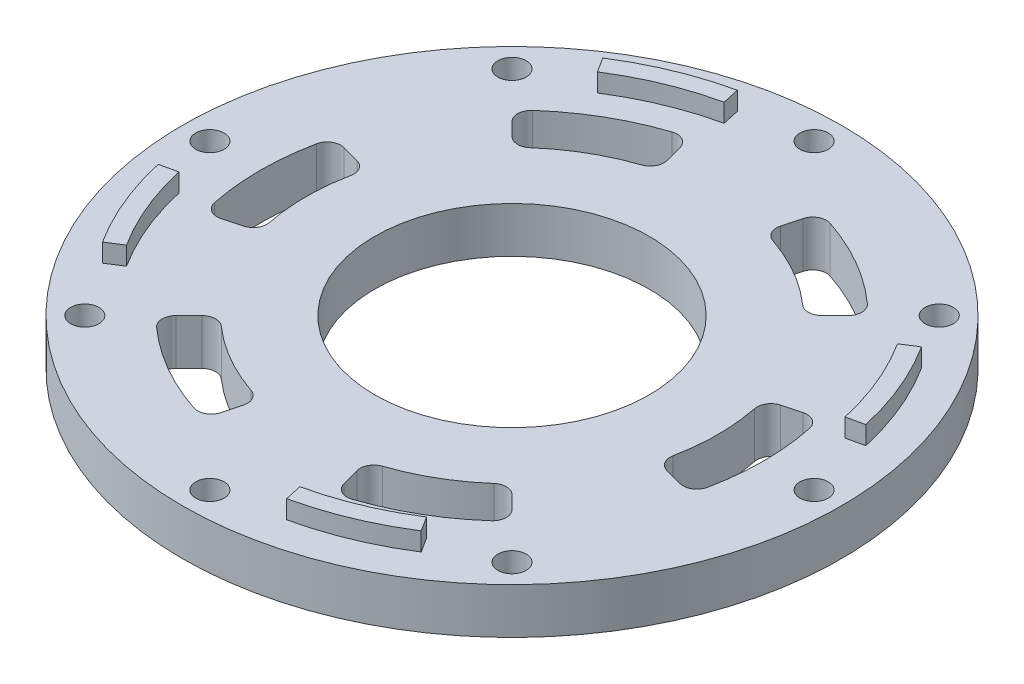
from build123d import *

# Parameters (mm, degrees)
SKETCH1_R                = 36
BOSS_EXTRUDE1_DEPTH      = 5
SKETCH2_R                = 15
CUT_EXTRUDE1_DEPTH       = 5
CUT_EXTRUDE3_DEPTH       = 5
FILLET1_R                = 1.5
CIRPATTERN1_COUNT        = 6
FILLET1_OF_CIRPATTERN1_R = 1.5
SKETCH4_R                = 1.55
CUT_EXTRUDE4_DEPTH       = 5
CIRPATTERN2_COUNT        = 8
BOSS_EXTRUDE2_DEPTH      = 2
CIRPATTERN3_COUNT        = 4


with BuildPart() as part:
    # Sketch1 → Boss-Extrude1 (new body)
    with BuildSketch(Plane(origin=(0, 0, 0), x_dir=(1, 0, 0), z_dir=(0, 1, 0))):
        with Locations(Location((0, 0, 0), (0, 0, 270))):
            Circle(SKETCH1_R)
    extrude(amount=BOSS_EXTRUDE1_DEPTH)

    # Sketch2 → Cut-Extrude1 (cut)
    with BuildSketch(Plane(origin=(0, 5, 0), x_dir=(1, 0, 0), z_dir=(0, 1, 0))):
        with Locations(Location((0, 0, 0), (0, 0, 270))):
            Circle(SKETCH2_R)
    extrude(amount=-CUT_EXTRUDE1_DEPTH, mode=Mode.SUBTRACT)

    # Sketch3 → Cut-Extrude3 (cut)
    with BuildSketch(Plane(origin=(0, 5, 0), x_dir=(1, 0, 0), z_dir=(0, 1, 0))):
        with BuildLine():
            Line((-15.909902577, 15.909902577), (-19.445436483, 19.445436483))
            ThreePointArc((-19.445436483, 19.445436483), (-13.75, 23.815698604), (-7.11752374, 26.562960223))
            Line((-7.11752374, 26.562960223), (-5.823428515, 21.733331092))
            ThreePointArc((-5.823428515, 21.733331092), (-11.25, 19.485571585), (-15.909902577, 15.909902577))
        make_face()
    cut_extrude3 = extrude(amount=-CUT_EXTRUDE3_DEPTH, mode=Mode.SUBTRACT)

    # Fillet1
    fillet1_edges = [part.edges().sort_by_distance(p)[0] for p in [
        (-19.445436483, 2.5, -19.445436483),
        (-7.11752374, 2.5, -26.562960223),
        (-5.823428515, 2.5, -21.733331092),
        (-15.909902577, 2.5, -15.909902577),
    ]]
    fillet(fillet1_edges, radius=FILLET1_R)

    # CirPattern1: Cut-Extrude3 ×6 about axis
    cirpattern1_axis = Axis((0, 0, 0), (0, 1, 0))
    for i in range(1, CIRPATTERN1_COUNT):
        add(cut_extrude3.rotate(cirpattern1_axis, i * 360 / CIRPATTERN1_COUNT), mode=Mode.SUBTRACT)

    # Fillet1 of CirPattern1
    fillet1_of_cirpattern1_edges = [part.edges().sort_by_distance(p)[0] for p in [
        (-26.562960223, 2.5, 7.11752374),
        (-26.562960223, 2.5, -7.11752374),
        (-21.733331092, 2.5, -5.823428515),
        (-21.733331092, 2.5, 5.823428515),
        (-7.11752374, 2.5, 26.562960223),
        (-19.445436483, 2.5, 19.445436483),
        (-15.909902577, 2.5, 15.909902577),
        (-5.823428515, 2.5, 21.733331092),
        (19.445436483, 2.5, 19.445436483),
        (7.11752374, 2.5, 26.562960223),
        (5.823428515, 2.5, 21.733331092),
        (15.909902577, 2.5, 15.909902577),
        (26.562960223, 2.5, -7.11752374),
        (26.562960223, 2.5, 7.11752374),
        (21.733331092, 2.5, 5.823428515),
        (21.733331092, 2.5, -5.823428515),
        (7.11752374, 2.5, -26.562960223),
        (19.445436483, 2.5, -19.445436483),
        (15.909902577, 2.5, -15.909902577),
        (5.823428515, 2.5, -21.733331092),
    ]]
    fillet(fillet1_of_cirpattern1_edges, radius=FILLET1_OF_CIRPATTERN1_R)

    # Sketch4 → Cut-Extrude4 (cut)
    with BuildSketch(Plane(origin=(0, 5, 0), x_dir=(1, 0, 0), z_dir=(0, 1, 0))):
        with Locations(Location((0, 33, 0), (0, 0, 270))):
            Circle(SKETCH4_R)
    cut_extrude4 = extrude(amount=-CUT_EXTRUDE4_DEPTH, mode=Mode.SUBTRACT)

    # CirPattern2: Cut-Extrude4 ×8 about axis
    cirpattern2_axis = Axis((0, 0, 0), (0, 1, 0))
    for i in range(1, CIRPATTERN2_COUNT):
        add(cut_extrude4.rotate(cirpattern2_axis, i * 360 / CIRPATTERN2_COUNT), mode=Mode.SUBTRACT)

    # Sketch6 → Boss-Extrude2 (add)
    with BuildSketch(Plane(origin=(0, 5, 0), x_dir=(1, 0, 0), z_dir=(0, 1, 0))):
        with BuildLine():
            Line((-16.387638055, 25.723439097), (-17.40850731, 27.325882844))
            ThreePointArc((-17.40850731, 27.325882844), (-12.398943209, 29.933696853), (-7.012643492, 31.631990631))
            Line((-7.012643492, 31.631990631), (-6.601408225, 29.777028217))
            ThreePointArc((-6.601408225, 29.777028217), (-11.671844687, 28.178325742), (-16.387638055, 25.723439097))
        make_face()
    boss_extrude2 = extrude(amount=BOSS_EXTRUDE2_DEPTH)

    # CirPattern3: Boss-Extrude2 ×4 about axis
    cirpattern3_axis = Axis((0, 5, 0), (0, -1, 0))
    for i in range(1, CIRPATTERN3_COUNT):
        add(boss_extrude2.rotate(cirpattern3_axis, i * 360 / CIRPATTERN3_COUNT))


solid = part.part
